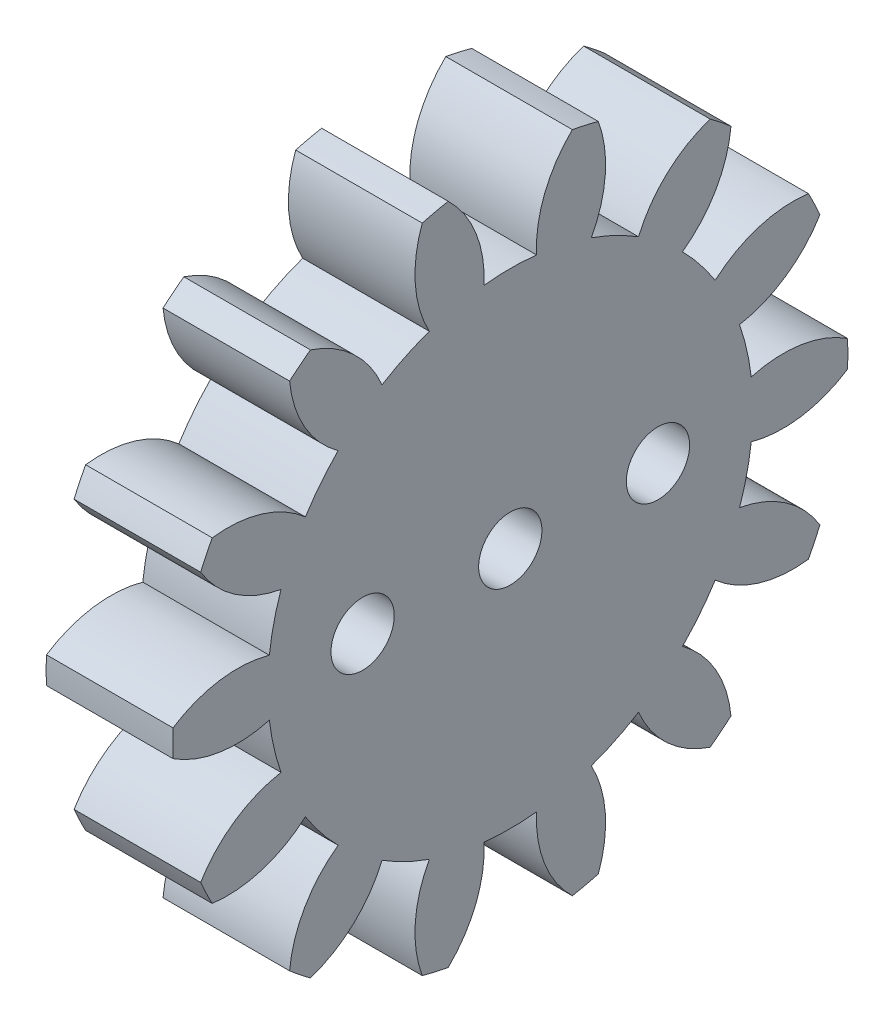
from build123d import *

# Parameters (mm, degrees)
BASPROSKE_W             = 6
BASPROSKE_H             = 16
TOOTHCUT_DEPTH          = 24.409399821
TEETHCUTS_COUNT         = 14
TEETHCUTS_ANGLE         = 334.285714286
BORSKE_R                = 4
BORE_DEPTH              = 50.0000508
CROQUIS1_R              = 4
CROQUIS1_R_2            = 1.5
SALIENTE_EXTRUIR1_DEPTH = 6
CROQUIS2_R              = 1.5
CORTAR_EXTRUIR1_DEPTH   = 6


with BuildPart() as part:
    # BasProSke → Base-Revolve (revolve)
    with BuildSketch(Plane(origin=(0, 0, 0), x_dir=(1, 0, 0), z_dir=(0, 1, 0)), mode=Mode.PRIVATE) as base_revolve_sk:
        with Locations((3, 8)):
            Rectangle(BASPROSKE_W, BASPROSKE_H)
    revolve(base_revolve_sk.sketch.rotate(Axis((-10, 0, 0), (1, 0, 0)), 180), axis=Axis((-10, 0, 0), (1, 0, 0)))

    # TooCutSke → ToothCut (cut, through all)
    with BuildSketch(Plane(origin=(0, 0, 0), x_dir=(0, 0, -1), z_dir=(1, 0, 0))):
        with BuildLine():
            ThreePointArc((1.24325535, 11.43159294), (0, 11.499), (-1.24325535, 11.43159294))
            ThreePointArc((-1.24325535, 11.43159294), (-1.634728087, 13.77719646), (-2.964256081, 15.748861262))
            ThreePointArc((-2.964256081, 15.748861262), (0, 16.0254), (2.964256081, 15.748861262))
            ThreePointArc((2.964256081, 15.748861262), (1.634728087, 13.77719646), (1.24325535, 11.43159294))
        make_face()
    toothcut = extrude(amount=TOOTHCUT_DEPTH, mode=Mode.SUBTRACT)

    # TeethCuts: ToothCut ×14 about axis
    teethcuts_axis = Axis((-10, 0, 0), (1, 0, 0))
    for i in range(1, TEETHCUTS_COUNT):
        add(toothcut.rotate(teethcuts_axis, i * TEETHCUTS_ANGLE / (TEETHCUTS_COUNT - 1)), mode=Mode.SUBTRACT)

    # BorSke → Bore (cut, symmetric)
    with BuildSketch(Plane(origin=(0, 0, 0), x_dir=(0, 0, -1), z_dir=(1, 0, 0))):
        with Locations(Location((0, 0, 0), (0, 0, 180))):
            Circle(BORSKE_R)
    extrude(amount=BORE_DEPTH, both=True, mode=Mode.SUBTRACT)

    # Croquis1 → Saliente-Extruir1 (add)
    with BuildSketch(Plane(origin=(6, 0, 0), x_dir=(0, 0, -1), z_dir=(1, 0, 0))):
        Circle(CROQUIS1_R)
        Circle(CROQUIS1_R_2, mode=Mode.SUBTRACT)
    extrude(amount=-SALIENTE_EXTRUIR1_DEPTH)

    # Croquis2 → Cortar-Extruir1 (cut)
    with BuildSketch(Plane(origin=(6, 0, 0), x_dir=(0, 0, -1), z_dir=(1, 0, 0))):
        with Locations((-7, 0)):
            Circle(CROQUIS2_R)
        with Locations((7, 0)):
            Circle(CROQUIS2_R)
    extrude(amount=-CORTAR_EXTRUIR1_DEPTH, mode=Mode.SUBTRACT)


solid = part.part
